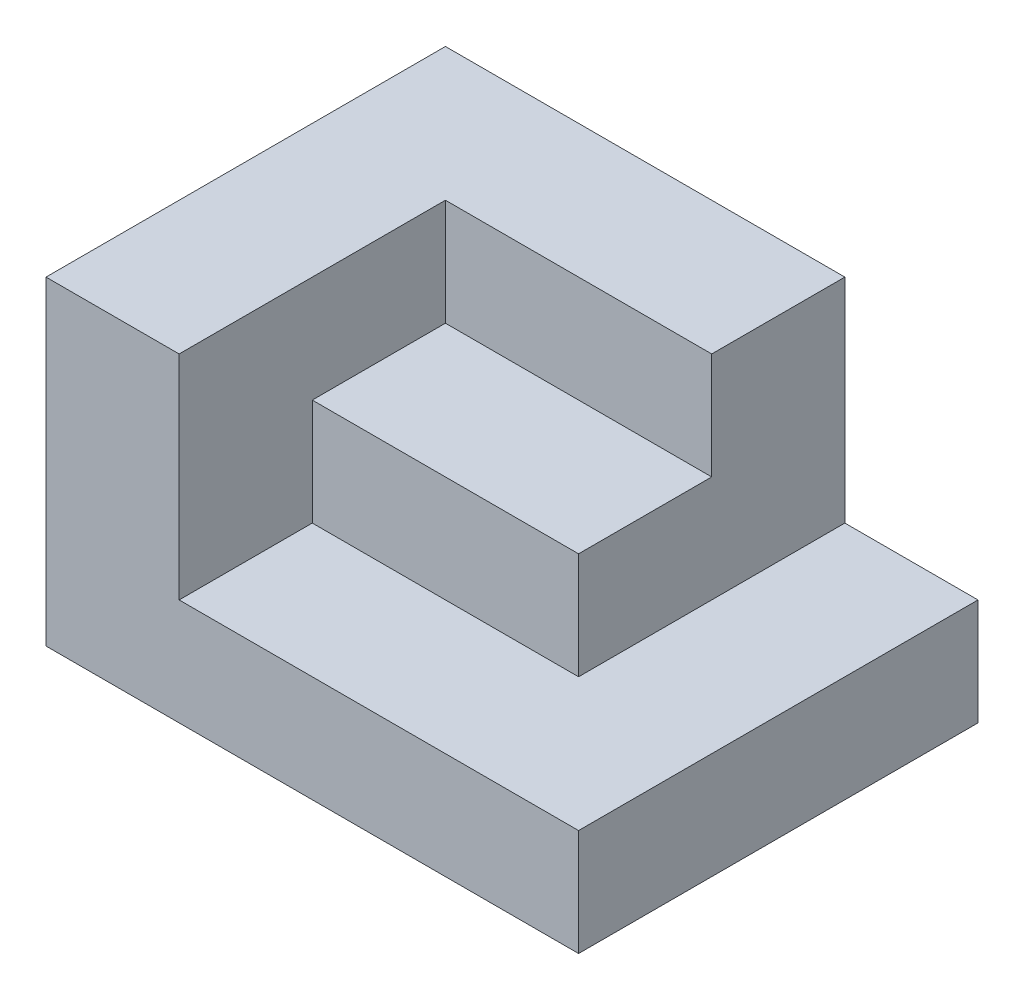
from build123d import *

# Parameters (mm, degrees)
SKETCH1_W               = 100
SKETCH1_H               = 75
BOSS_EXTRUDE1_DEPTH     = 60
CUT_EXTRUDE1_DEPTH      = 87.638617256
CUT_EXTRUDE1_DEPTH_BACK = 40
CUT_EXTRUDE2_DEPTH      = 87.638617256
CUT_EXTRUDE2_DEPTH_BACK = 20


with BuildPart() as part:
    # Sketch1 → Boss-Extrude1 (new body)
    with BuildSketch(Plane(origin=(0, 0, 0), x_dir=(1, 0, 0), z_dir=(0, 1, 0))):
        Rectangle(SKETCH1_W, SKETCH1_H)
    extrude(amount=BOSS_EXTRUDE1_DEPTH)

    # Sketch2 → Cut-Extrude1 (cut, two sides: drawn at the far end of the back side and taken through both)
    with BuildSketch(Plane(origin=(0, 60, 0), x_dir=(1, 0, 0), z_dir=(0, 1, 0)).offset(-CUT_EXTRUDE1_DEPTH_BACK)):
        Polygon((-25, -259.632034356), (-25, -37.5), (-25, -12.5), (25, -12.5), (25, 37.5), (25, 259.632034356), (467.218719806, 217.050740324), (417.218719806, -302.213328388), align=None)
    extrude(amount=CUT_EXTRUDE1_DEPTH + CUT_EXTRUDE1_DEPTH_BACK, mode=Mode.SUBTRACT)

    # Sketch3 → Cut-Extrude2 (cut, two sides: drawn at the far end of the back side and taken through both)
    with BuildSketch(Plane(origin=(0, 60, 0), x_dir=(1, 0, 0), z_dir=(0, 1, 0)).offset(-CUT_EXTRUDE2_DEPTH_BACK)):
        Polygon((-25, -234.632034356), (-25, -12.5), (-25, 12.5), (25, 12.5), (25, 37.5), (25, 259.632034356), (467.008191751, 214.918264963), (417.008191751, -279.345803749), align=None)
    extrude(amount=CUT_EXTRUDE2_DEPTH + CUT_EXTRUDE2_DEPTH_BACK, mode=Mode.SUBTRACT)


solid = part.part
